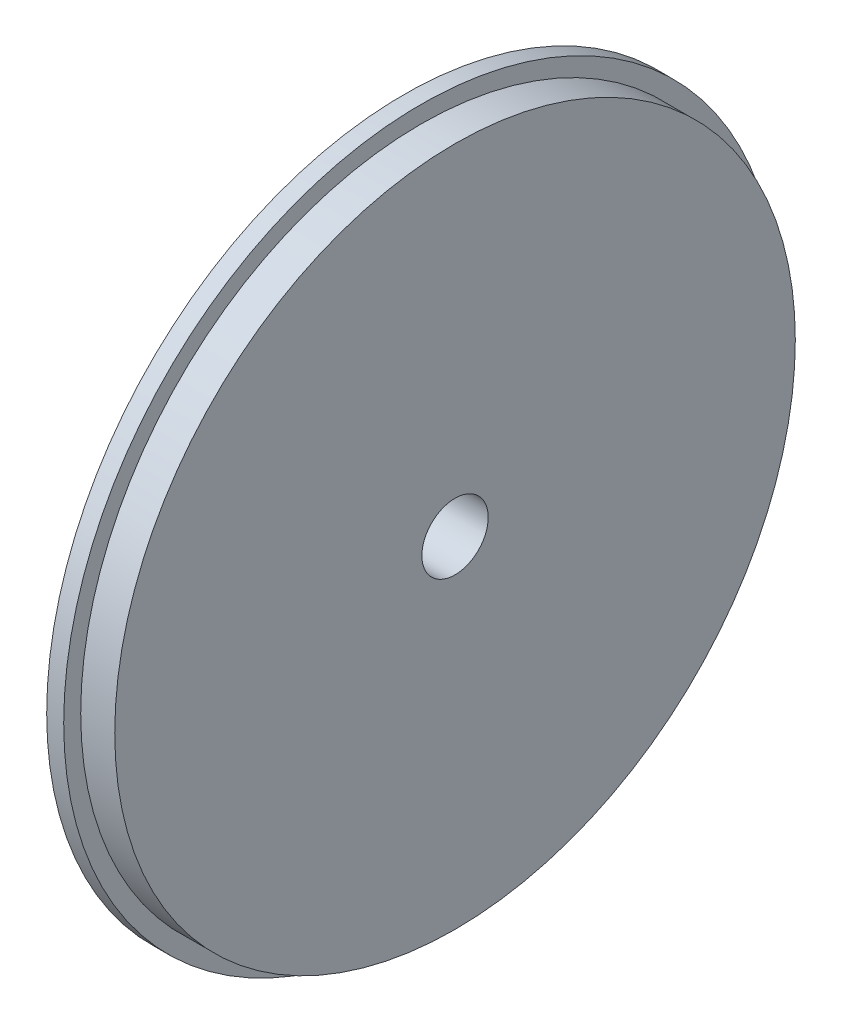
from build123d import *


with BuildPart() as part:
    # Sketch1 → Revolve1 (revolve)
    with BuildSketch(Plane.XY, mode=Mode.PRIVATE) as revolve1_sk:
        Polygon((-0.75, 10.5), (-0.25, 10.5), (-0.25, 10), (0.75, 10), (0.75, 0.975), (-0.75, 0.975), align=None)
    revolve(revolve1_sk.sketch.rotate(Axis((-0.75, 0, 0), (1, 0, 0)), 90), axis=Axis((-0.75, 0, 0), (1, 0, 0)))


solid = part.part
